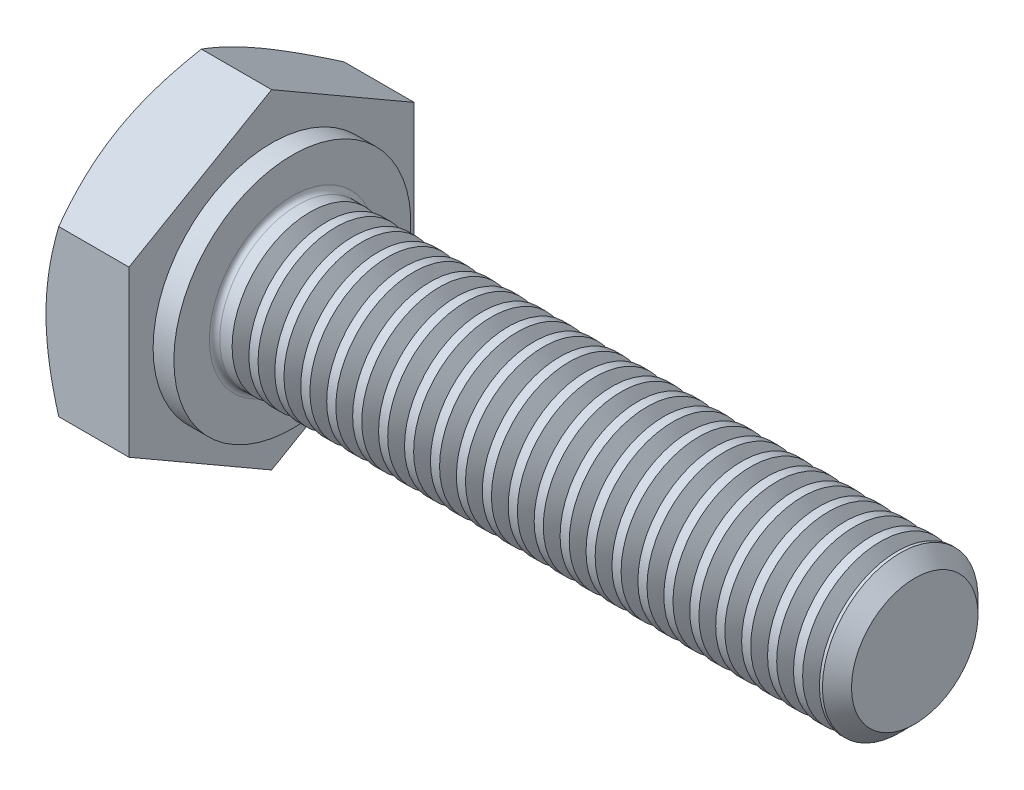
from build123d import *

# Parameters (mm, degrees)
BASEHEAD_DEPTH   = 2
BEARINGFACESKE_W = 0.4
BEARINGFACESKE_H = 0.890426481
FILLET_2_R       = 0.1
THDSCHPAT_COUNT  = 23
THDSCHPAT_PITCH  = 0.5


with BuildPart() as part:
    # BaseHeadSke → BaseHead (new body)
    with BuildSketch(Plane(origin=(0, 0, 0), x_dir=(0, 0, -1), z_dir=(1, 0, 0))):
        Polygon((2.75, 1.58771324), (0, 3.175426481), (-2.75, 1.58771324), (-2.75, -1.58771324), (0, -3.175426481), (2.75, -1.58771324), align=None)
    extrude(amount=BASEHEAD_DEPTH)

    # BodySke → BaseBody (revolve)
    with BuildSketch(Plane.XY, mode=Mode.PRIVATE) as basebody_sk:
        Polygon((0, 0), (14, 0), (14, 1.2195), (13.7195, 1.5), (0, 1.5), align=None)
    revolve(basebody_sk.sketch.rotate(Axis((0, 0, 0), (1, 0, 0)), 90), axis=Axis((0, 0, 0), (1, 0, 0)))

    # HeadChamferSke → HeadChamfer (revolve, cut)
    with BuildSketch(Plane.XY):
        Polygon((0.245620093, 3.175426481), (0, 3.175426481), (0, 2.75), align=None)
    revolve(axis=Axis((0, 0, 0), (1, 0, 0)), mode=Mode.SUBTRACT)

    # BearingFaceSke → BearingFace (revolve, cut)
    with BuildSketch(Plane.XY, mode=Mode.PRIVATE) as bearingface_sk:
        with Locations((1.8, 2.730213241)):
            Rectangle(BEARINGFACESKE_W, BEARINGFACESKE_H)
    revolve(bearingface_sk.sketch.rotate(Axis((0, 0, 0), (1, 0, 0)), 90), axis=Axis((0, 0, 0), (1, 0, 0)), mode=Mode.SUBTRACT)

    # Fillet 2
    fillet_2_edges = [part.edges().sort_by_distance(p)[0] for p in [
        (2, 0, -1.5),
    ]]
    fillet(fillet_2_edges, radius=FILLET_2_R)

    # ThdSchSke → ThreadSchematic (revolve, cut)
    with BuildSketch(Plane.XY, mode=Mode.PRIVATE) as threadschematic_sk:
        Polygon((13.338053249, 1.823893501), (13.338053249, 1.5), (13.5, 1.2195), (13.661946751, 1.5), (13.661946751, 1.823893501), align=None)
    threadschematic = revolve(threadschematic_sk.sketch.rotate(Axis((0, 0, 0), (1, 0, 0)), 90), axis=Axis((0, 0, 0), (1, 0, 0)), mode=Mode.SUBTRACT)

    # ThdSchPat: ThreadSchematic ×23
    with Locations(*[(-i * THDSCHPAT_PITCH, 0, 0) for i in range(1, THDSCHPAT_COUNT)]):
        add(threadschematic, mode=Mode.SUBTRACT)


solid = part.part
